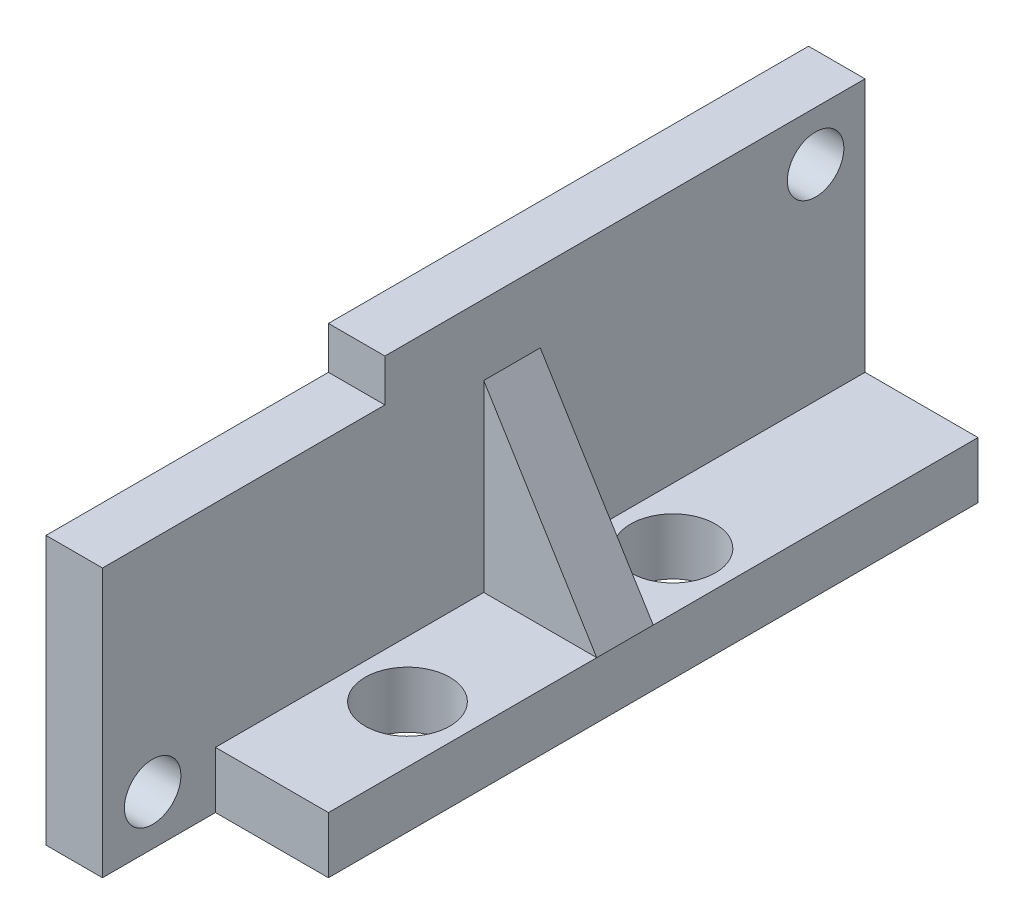
from build123d import *

# Parameters (mm, degrees)
BOSS_EXTRUDE1_DEPTH = 13.5
SKETCH2_W           = 10
SKETCH2_H           = 1.5
CUT_EXTRUDE1_DEPTH  = 27
SKETCH3_R           = 1
CUT_EXTRUDE2_DEPTH  = 3.6
SKETCH6_W           = 6
SKETCH6_H           = 2
BOSS_EXTRUDE2_DEPTH = 3
SKETCH7_R           = 1.5
CUT_EXTRUDE5_DEPTH  = 9
BOSS_EXTRUDE3_DEPTH = 2
SKETCH10_W          = 6
SKETCH10_H          = 3
CUT_EXTRUDE6_DEPTH  = 10
SKETCH11_W          = 4
SKETCH11_H          = 4
CUT_EXTRUDE7_DEPTH  = 10


with BuildPart() as part:
    # Sketch1 → Boss-Extrude1 (new, symmetric)
    with BuildSketch(Plane.XY):
        Polygon((0, 11), (0, 0), (6, 0), (6, 2), (2, 2), (2, 11), align=None)
    extrude(amount=BOSS_EXTRUDE1_DEPTH, both=True)

    # Sketch2 → Cut-Extrude1 (cut)
    with BuildSketch(Plane(origin=(2, 0, 0), x_dir=(0, 0, -1), z_dir=(1, 0, 0))):
        with Locations((-8.5, 10.25)):
            Rectangle(SKETCH2_W, SKETCH2_H)
    extrude(amount=-CUT_EXTRUDE1_DEPTH, mode=Mode.SUBTRACT)

    # Sketch3 → Cut-Extrude2 (cut)
    with BuildSketch(Plane.ZY):
        with Locations(Location((-11.75, 9.25, 0), (0, 0, 270))):
            Circle(SKETCH3_R)
        with Locations(Location((11.723777669, 1.75, 0), (0, 0, 270))):
            Circle(SKETCH3_R)
    extrude(amount=-CUT_EXTRUDE2_DEPTH, mode=Mode.SUBTRACT)

    # Sketch6 → Boss-Extrude2 (add)
    with BuildSketch(Plane(origin=(0, 0, -13.5), x_dir=(-1, 0, 0), z_dir=(0, 0, -1))):
        with Locations((-3, 1)):
            Rectangle(SKETCH6_W, SKETCH6_H)
    extrude(amount=BOSS_EXTRUDE2_DEPTH)

    # Sketch7 → Cut-Extrude5 (cut)
    with BuildSketch(Plane(origin=(0, 2, 0), x_dir=(1, 0, 0), z_dir=(0, 1, 0))):
        with Locations(Location((4, -4.7, 0), (0, 0, 180))):
            Circle(SKETCH7_R)
        with Locations(Location((4, 4.7, 0), (0, 0, 270))):
            Circle(SKETCH7_R)
    extrude(amount=-CUT_EXTRUDE5_DEPTH, mode=Mode.SUBTRACT)

    # Sketch9 → Boss-Extrude3 (add)
    with BuildSketch(Plane.XY):
        Polygon((2, 8.5), (2, 2), (6, 2), align=None)
    extrude(amount=-BOSS_EXTRUDE3_DEPTH)

    # Sketch10 → Cut-Extrude6 (cut)
    with BuildSketch(Plane(origin=(0, 2, 0), x_dir=(1, 0, 0), z_dir=(0, 1, 0))):
        with Locations((3, 15)):
            Rectangle(SKETCH10_W, SKETCH10_H)
    extrude(amount=-CUT_EXTRUDE6_DEPTH, mode=Mode.SUBTRACT)

    # Sketch11 → Cut-Extrude7 (cut)
    with BuildSketch(Plane(origin=(0, 2, 0), x_dir=(1, 0, 0), z_dir=(0, 1, 0))):
        with Locations((4, -11.5)):
            Rectangle(SKETCH11_W, SKETCH11_H)
    extrude(amount=-CUT_EXTRUDE7_DEPTH, mode=Mode.SUBTRACT)


solid = part.part
